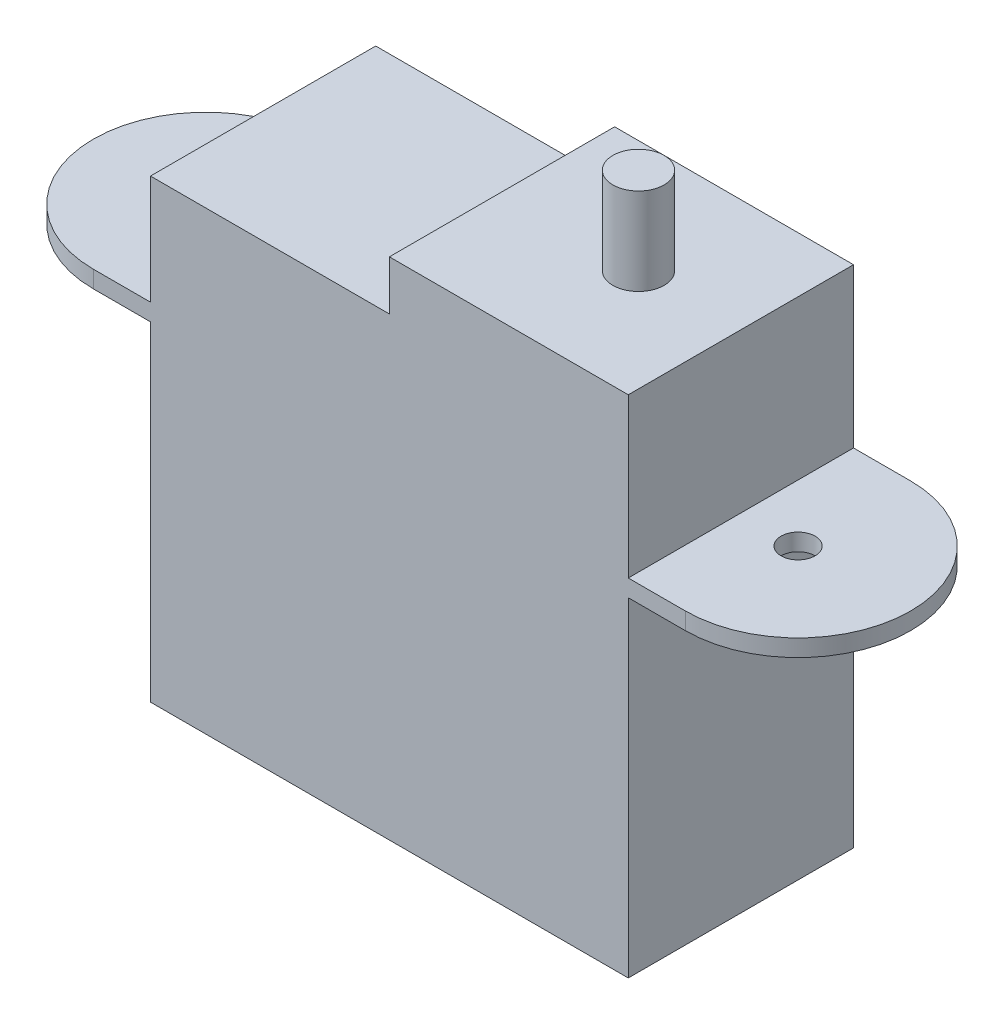
from build123d import *

# Parameters (mm, degrees)
SKETCH1_W           = 28
SKETCH1_H           = 13.2
BOSS_EXTRUDE1_DEPTH = 19.3
BOSS_EXTRUDE2_DEPTH = 1
SKETCH3_W           = 28
SKETCH3_H           = 13.2
BOSS_EXTRUDE3_DEPTH = 9.3
CUT_EXTRUDE1_DEPTH  = 20.2
SKETCH5_R           = 1
CUT_EXTRUDE2_DEPTH  = 46.017024557
SKETCH6_R           = 1.5
BOSS_EXTRUDE4_DEPTH = 5.1


with BuildPart() as part:
    # Sketch1 → Boss-Extrude1 (new body)
    with BuildSketch(Plane(origin=(0, 0, 0), x_dir=(1, 0, 0), z_dir=(0, 1, 0))):
        with Locations((14, 6.6)):
            Rectangle(SKETCH1_W, SKETCH1_H)
    extrude(amount=BOSS_EXTRUDE1_DEPTH)

    # Sketch2 → Boss-Extrude2 (add)
    with BuildSketch(Plane(origin=(0, 19.3, 0), x_dir=(1, 0, 0), z_dir=(0, 1, 0))):
        with BuildLine():
            Line((-3.35, 13.2), (31.35, 13.2))
            ThreePointArc((31.35, 13.2), (37.95, 6.6), (31.35, 0))
            Line((31.35, 0), (-3.35, 0))
            ThreePointArc((-3.35, 0), (-9.95, 6.6), (-3.35, 13.2))
        make_face()
    extrude(amount=BOSS_EXTRUDE2_DEPTH)

    # Sketch3 → Boss-Extrude3 (add)
    with BuildSketch(Plane(origin=(0, 20.3, 0), x_dir=(1, 0, 0), z_dir=(0, 1, 0))):
        with Locations((14, 6.6)):
            Rectangle(SKETCH3_W, SKETCH3_H)
    extrude(amount=BOSS_EXTRUDE3_DEPTH)

    # Sketch4 → Cut-Extrude1 (cut)
    with BuildSketch(Plane.XY):
        Polygon((0, 26.7), (7, 26.7), (14, 26.7), (14, 29.6), (28, 29.6), (28, 24.95), (30, 24.95), (30, 31.6), (0, 31.6), align=None)
    extrude(amount=-CUT_EXTRUDE1_DEPTH, mode=Mode.SUBTRACT)

    # Sketch5 → Cut-Extrude2 (cut, through all)
    with BuildSketch(Plane(origin=(0, 20.3, 0), x_dir=(1, 0, 0), z_dir=(0, 1, 0))):
        with Locations(Location((-3.35, 6.6, 0), (0, 0, 270))):
            Circle(SKETCH5_R)
        with Locations(Location((31.35, 6.6, 0), (0, 0, 270))):
            Circle(SKETCH5_R)
    extrude(amount=-CUT_EXTRUDE2_DEPTH, mode=Mode.SUBTRACT)

    # Sketch6 → Boss-Extrude4 (add)
    with BuildSketch(Plane(origin=(0, 29.6, 0), x_dir=(1, 0, 0), z_dir=(0, 1, 0))):
        with Locations(Location((22, 6.6, 0), (0, 0, 90))):
            Circle(SKETCH6_R)
    extrude(amount=BOSS_EXTRUDE4_DEPTH)


solid = part.part
